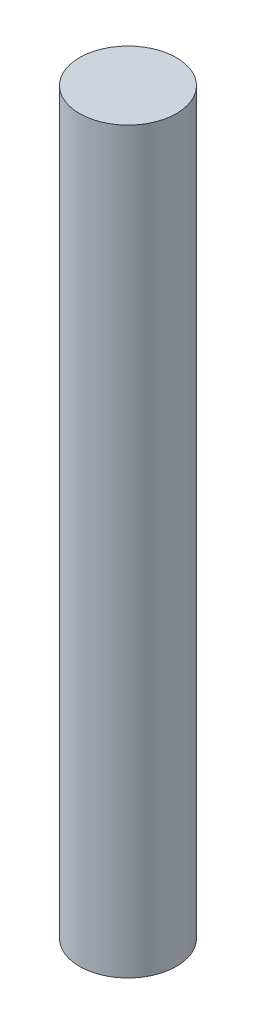
from build123d import *

# Parameters (mm, degrees)
SKETCH1_R           = 12.5
BOSS_EXTRUDE1_DEPTH = 190.5


with BuildPart() as part:
    # Sketch1 → Boss-Extrude1 (new body)
    with BuildSketch(Plane(origin=(0, 0, 0), x_dir=(1, 0, 0), z_dir=(0, 1, 0))):
        with Locations(Location((0, 0, 0), (0, 0, 270))):
            Circle(SKETCH1_R)
    extrude(amount=BOSS_EXTRUDE1_DEPTH)


solid = part.part
